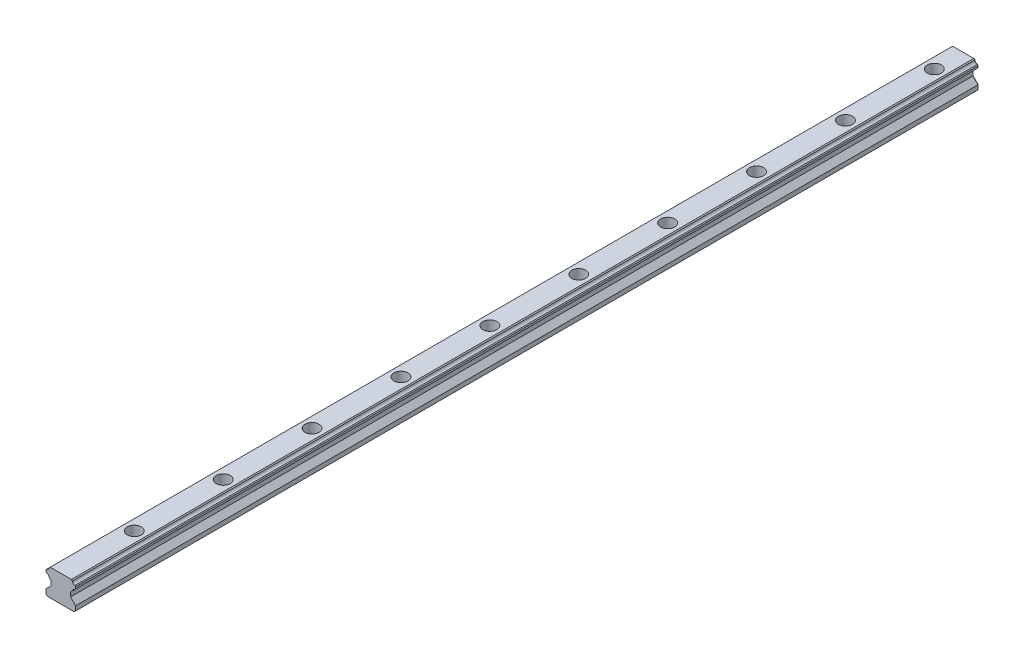
from build123d import *

# Parameters (mm, degrees)
BOSS_EXTRUDE1_DEPTH      = 320
BOSS_EXTRUDE1_DEPTH_BACK = 320
LPATTERN2_COUNT          = 11
LPATTERN2_PITCH          = 60
CHAMFER1_SIZE            = 0.5
CUT_EXTRUDE1_DEPTH       = 321.661815625
CUT_EXTRUDE1_DEPTH_BACK  = 321.661815625


with BuildPart() as part:
    # Sketch3 → Boss-Extrude1 (new, two sides: drawn at the far end of the back side and taken through both)
    with BuildSketch(Plane.XY.offset(-BOSS_EXTRUDE1_DEPTH_BACK)):
        with BuildLine():
            Line((3, 9), (-3, 9))
            Line((-3, 9), (-7.160036564, 9))
            Line((-7.160036564, 9), (-7.767930373, 8.392105714))
            ThreePointArc((-7.767930373, 8.392105714), (-8.344874488, 7.264307267), (-9.472673258, 6.687363783))
            Line((-9.472673258, 6.687363783), (-10, 6.160037041))
            Line((-10, 6.160037041), (-10, 4.82918644))
            Line((-10, 4.82918644), (-9.472673258, 4.314376637))
            ThreePointArc((-9.472673258, 4.314376637), (-8.341068744, 3.731631743), (-7.767930373, 2.595131504))
            Line((-7.767930373, 2.595131504), (-6.550048828, 1.379235268))
            Line((-6.550048828, 1.379235268), (-6.550048828, -1.550048828))
            Line((-6.550048828, -1.550048828), (-10, -4.999922752))
            Line((-10, -4.999922752), (-10, -8))
            Line((-10, -8), (-9, -9))
            Line((-9, -9), (0, -9))
            Line((0, -9), (9, -9))
            Line((9, -9), (10, -8))
            Line((10, -8), (10, -4.999922752))
            Line((10, -4.999922752), (6.550048828, -1.550048828))
            Line((6.550048828, -1.550048828), (6.550048828, 1.379235268))
            Line((6.550048828, 1.379235268), (7.767930373, 2.595131504))
            ThreePointArc((7.767930373, 2.595131504), (8.341068744, 3.731631743), (9.472673258, 4.314376637))
            Line((9.472673258, 4.314376637), (10, 4.82918644))
            Line((10, 4.82918644), (10, 6.160037041))
            Line((10, 6.160037041), (9.472673258, 6.687363783))
            ThreePointArc((9.472673258, 6.687363783), (8.344874488, 7.264307267), (7.767930373, 8.392105714))
            Line((7.767930373, 8.392105714), (7.160036564, 9))
            Line((7.160036564, 9), (3, 9))
        make_face()
    extrude(amount=BOSS_EXTRUDE1_DEPTH + BOSS_EXTRUDE1_DEPTH_BACK)

    # Sketch4 → Cut-Revolve1 (revolve, cut)
    with BuildSketch(Plane(origin=(0, 0, 0), x_dir=(0, 0, -1), z_dir=(1, 0, 0)), mode=Mode.PRIVATE) as cut_revolve1_sk:
        Polygon((-295.25, 9), (-300, 9), (-300, -9), (-297, -9), (-297, 0.5), (-295.25, 0.5), align=None)
    cut_revolve1 = revolve(cut_revolve1_sk.sketch.rotate(Axis((0, 9, 300), (0, -1, 0)), 180), axis=Axis((0, 9, 300), (0, -1, 0)), mode=Mode.SUBTRACT)

    # LPattern2: Cut-Revolve1 ×11
    with Locations(*[(0, 0, -i * LPATTERN2_PITCH) for i in range(1, LPATTERN2_COUNT)]):
        add(cut_revolve1, mode=Mode.SUBTRACT)

    # Chamfer1
    chamfer1_edges = [part.edges().sort_by_distance(p)[0] for p in [
        (-6.550048828, -0.08540678, 320),
        (-8.275024414, -3.27498579, 320),
        (-10, -6.499961376, 320),
        (-9.5, -8.5, 320),
        (0, -9, 320),
        (9.5, -8.5, 320),
        (10, -6.499961376, 320),
        (8.275024414, -3.27498579, 320),
        (6.550048828, -0.08540678, 320),
        (-8.341068744, 3.731631743, 320),
        (7.158989601, 1.987183386, 320),
        (8.341068744, 3.731631743, 320),
        (9.736336629, 4.571781538, 320),
        (-9.736336629, 4.571781538, -320),
        (-10, 5.49461174, -320),
        (10, 5.49461174, 320),
        (-9.736336629, 6.423700412, -320),
        (-7.463983469, 8.696052857, -320),
        (0, 9, -320),
        (7.463983469, 8.696052857, -320),
        (9.736336629, 6.423700412, -320),
        (10, 5.49461174, -320),
        (9.736336629, 6.423700412, 320),
        (9.736336629, 4.571781538, -320),
        (7.158989601, 1.987183386, -320),
        (6.550048828, -0.08540678, -320),
        (8.275024414, -3.27498579, -320),
        (10, -6.499961376, -320),
        (9.5, -8.5, -320),
        (0, -9, -320),
        (8.344874488, 7.264307267, 320),
        (-9.5, -8.5, -320),
        (-10, -6.499961376, -320),
        (-8.275024414, -3.27498579, -320),
        (-6.550048828, -0.08540678, -320),
        (-7.158989601, 1.987183386, -320),
        (-8.341068744, 3.731631743, -320),
        (-8.344874488, 7.264307267, -320),
        (8.344874488, 7.264307267, -320),
        (8.341068744, 3.731631743, -320),
        (7.463983469, 8.696052857, 320),
        (0, 9, 320),
        (-7.463983469, 8.696052857, 320),
        (-8.344874488, 7.264307267, 320),
        (-7.158989601, 1.987183386, 320),
        (-9.736336629, 6.423700412, 320),
        (-10, 5.49461174, 320),
        (-9.736336629, 4.571781538, 320),
    ]]
    chamfer(chamfer1_edges, length=CHAMFER1_SIZE)

    # Sketch7 → Cut-Extrude1 (cut, two sides: drawn at the far end of the back side and taken through both)
    with BuildSketch(Plane.XZ.offset(9).offset(-CUT_EXTRUDE1_DEPTH_BACK)):
        Polygon((1255.011383847, 289.6), (23.92488735, 289.6), (-18.541494628, 289.6), (-1249.627991125, 289.6), (-1249.627991125, 2751.772992994), (1255.011383847, 2751.772992994), align=None)
    extrude(amount=CUT_EXTRUDE1_DEPTH + CUT_EXTRUDE1_DEPTH_BACK, mode=Mode.SUBTRACT)


solid = part.part
